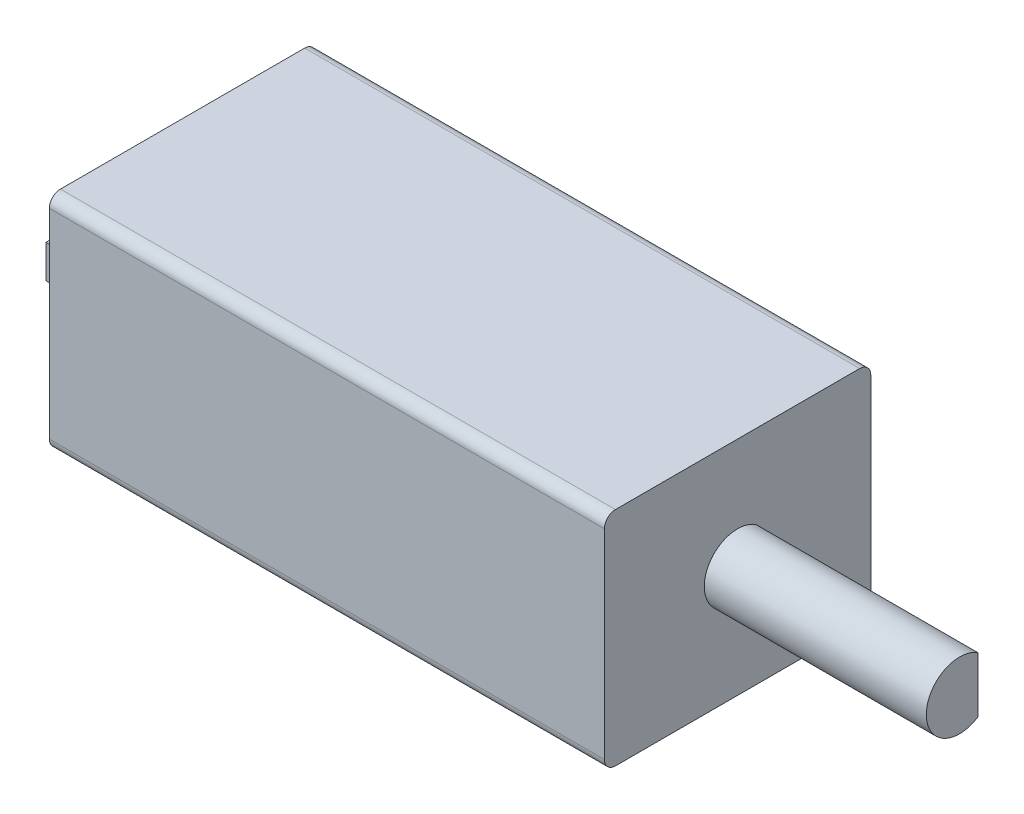
from build123d import *

# Parameters (mm, degrees)
EXTRUDE_1_DEPTH = 25
EXTRUDE_2_DEPTH = 10
SKETCH_3_W      = 0.3
SKETCH_3_H      = 1.5
EXTRUDE_3_DEPTH = 2.5


with BuildPart() as part:
    # 草图1 → 凸台-拉伸1 (new body)
    with BuildSketch(Plane(origin=(0, 0, 0), x_dir=(0, 0, -1), z_dir=(1, 0, 0))):
        with BuildLine():
            Line((-5.5, 5), (5.5, 5))
            ThreePointArc((5.5, 5), (5.853553391, 4.853553391), (6, 4.5))
            Line((6, 4.5), (6, -4.5))
            ThreePointArc((6, -4.5), (5.853553391, -4.853553391), (5.5, -5))
            Line((5.5, -5), (-5.5, -5))
            ThreePointArc((-5.5, -5), (-5.853553391, -4.853553391), (-6, -4.5))
            Line((-6, -4.5), (-6, 4.5))
            ThreePointArc((-6, 4.5), (-5.853553391, 4.853553391), (-5.5, 5))
        make_face()
    extrude(amount=EXTRUDE_1_DEPTH)

    # 草图2 → 凸台-拉伸2 (add)
    with BuildSketch(Plane(origin=(25, 0, 0), x_dir=(0, 0, -1), z_dir=(1, 0, 0))):
        with BuildLine():
            ThreePointArc((0.829156198, 1.25), (0.433012702, 1.436140662), (0, 1.5))
            Line((0, 1.5), (0, -1.5))
            ThreePointArc((0, -1.5), (0.433012702, -1.436140662), (0.829156198, -1.25))
            Line((0.829156198, -1.25), (0.829156198, 1.25))
        make_face()
        with BuildLine():
            Line((0, -1.5), (0, 1.5))
            ThreePointArc((0, 1.5), (-1.5, 0), (0, -1.5))
        make_face()
    extrude(amount=EXTRUDE_2_DEPTH)

    # 草图3 → 凸台-拉伸3 (add)
    with BuildSketch(Plane.ZY):
        with Locations((-3.5, 0)):
            Rectangle(SKETCH_3_W, SKETCH_3_H)
        with Locations((3.5, 0)):
            Rectangle(SKETCH_3_W, SKETCH_3_H)
    extrude(amount=EXTRUDE_3_DEPTH)


solid = part.part
